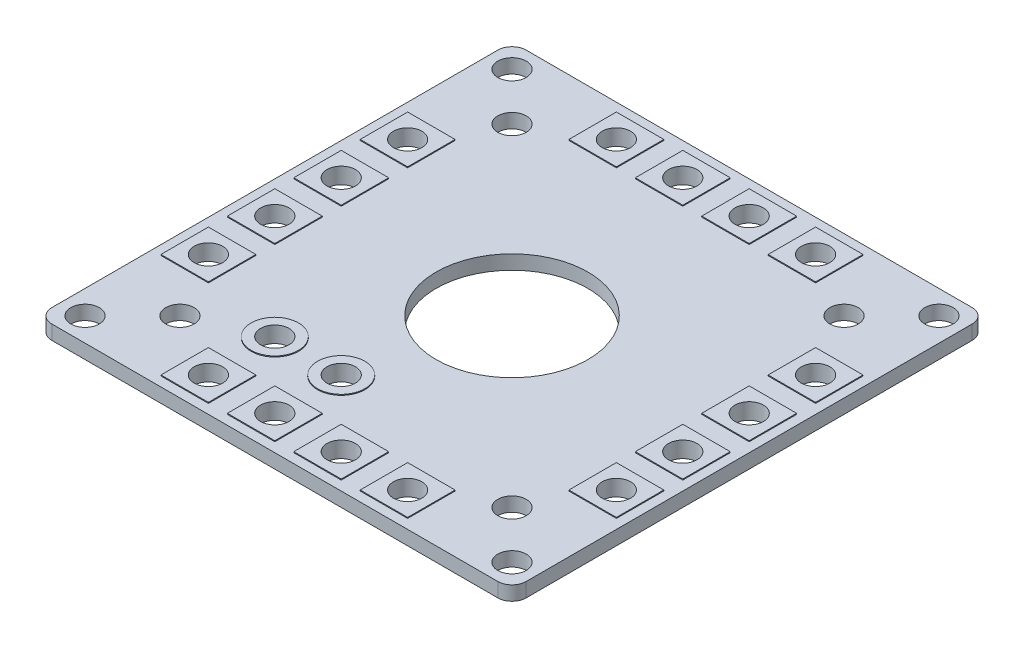
from build123d import *

# Parameters (mm, degrees)
SKETCH_1_R           = 1.5
EXTRUDE_1_DEPTH      = 1.5
SKETCH_2_R           = 8
SKETCH_2_W           = 5
SKETCH_2_H           = 5
SKETCH_2_R_2         = 2.5
CUT_EXTRUDE_1_DEPTH  = 36.387144558
EXTRUDE_2_DEPTH      = 1.6
EXTRUDE_2_DEPTH_BACK = 0.1
SKETCH_3_R           = 2.5
SKETCH_3_R_2         = 1.5
SKETCH_3_W           = 5
SKETCH_3_H           = 5


with BuildPart() as part:
    # Эскиз1 → Бобышка-Вытянуть1 (new body)
    with BuildSketch(Plane(origin=(0, 0, 0), x_dir=(1, 0, 0), z_dir=(0, 1, 0))):
        with BuildLine():
            Line((-23.5, 25), (23.5, 25))
            ThreePointArc((23.5, 25), (24.560660172, 24.560660172), (25, 23.5))
            Line((25, 23.5), (25, -23.5))
            ThreePointArc((25, -23.5), (24.560660172, -24.560660172), (23.5, -25))
            Line((23.5, -25), (-23.5, -25))
            ThreePointArc((-23.5, -25), (-24.560660172, -24.560660172), (-25, -23.5))
            Line((-25, -23.5), (-25, 23.5))
            ThreePointArc((-25, 23.5), (-24.560660172, 24.560660172), (-23.5, 25))
        make_face()
        with Locations(Location((-22.5, 22.5, 0), (0, 0, 270))):
            Circle(SKETCH_1_R, mode=Mode.SUBTRACT)
        with Locations(Location((22.5, 22.5, 0), (0, 0, 270))):
            Circle(SKETCH_1_R, mode=Mode.SUBTRACT)
        with Locations(Location((22.5, -22.5, 0), (0, 0, 270))):
            Circle(SKETCH_1_R, mode=Mode.SUBTRACT)
        with Locations(Location((-22.5, -22.5, 0), (0, 0, 270))):
            Circle(SKETCH_1_R, mode=Mode.SUBTRACT)
        with Locations(Location((-17.5, 17.5, 0), (0, 0, 270))):
            Circle(SKETCH_1_R, mode=Mode.SUBTRACT)
        with Locations(Location((17.5, 17.5, 0), (0, 0, 270))):
            Circle(SKETCH_1_R, mode=Mode.SUBTRACT)
        with Locations(Location((17.5, -17.5, 0), (0, 0, 270))):
            Circle(SKETCH_1_R, mode=Mode.SUBTRACT)
        with Locations(Location((-17.5, -17.5, 0), (0, 0, 270))):
            Circle(SKETCH_1_R, mode=Mode.SUBTRACT)
    extrude(amount=EXTRUDE_1_DEPTH)

    # Эскиз2 → Вырез-Вытянуть1 (cut, through all)
    with BuildSketch(Plane(origin=(0, 1.5, 0), x_dir=(1, 0, 0), z_dir=(0, 1, 0))):
        with Locations(Location((0, 0, 0), (0, 0, 270))):
            Circle(SKETCH_2_R)
        with Locations((-10.5, 21.5)):
            Rectangle(SKETCH_2_W, SKETCH_2_H)
        with Locations((-21.5, 10.5)):
            Rectangle(SKETCH_2_W, SKETCH_2_H)
        with Locations((-21.5, 3.5)):
            Rectangle(SKETCH_2_W, SKETCH_2_H)
        with Locations((-21.5, -3.5)):
            Rectangle(SKETCH_2_W, SKETCH_2_H)
        with Locations((-21.5, -10.5)):
            Rectangle(SKETCH_2_W, SKETCH_2_H)
        with Locations((-10.5, -21.5)):
            Rectangle(SKETCH_2_W, SKETCH_2_H)
        with Locations((-3.5, -21.5)):
            Rectangle(SKETCH_2_W, SKETCH_2_H)
        with Locations((3.5, -21.5)):
            Rectangle(SKETCH_2_W, SKETCH_2_H)
        with Locations((10.5, -21.5)):
            Rectangle(SKETCH_2_W, SKETCH_2_H)
        with Locations((21.5, -10.5)):
            Rectangle(SKETCH_2_W, SKETCH_2_H)
        with Locations((21.5, -3.5)):
            Rectangle(SKETCH_2_W, SKETCH_2_H)
        with Locations((21.5, 3.5)):
            Rectangle(SKETCH_2_W, SKETCH_2_H)
        with Locations((21.5, 10.5)):
            Rectangle(SKETCH_2_W, SKETCH_2_H)
        with Locations((-3.5, 21.5)):
            Rectangle(SKETCH_2_W, SKETCH_2_H)
        with Locations((10.5, 21.5)):
            Rectangle(SKETCH_2_W, SKETCH_2_H)
        with Locations((3.5, 21.5)):
            Rectangle(SKETCH_2_W, SKETCH_2_H)
        with Locations(Location((-10.5, -14.5, 0), (0, 0, 270))):
            Circle(SKETCH_2_R_2)
        with Locations(Location((-3.5, -14.5, 0), (0, 0, 270))):
            Circle(SKETCH_2_R_2)
    extrude(amount=-CUT_EXTRUDE_1_DEPTH, mode=Mode.SUBTRACT)

    # Эскиз3 → Бобышка-Вытянуть2 (add, two sides: drawn at the far end of the back side and taken through both)
    # profile 1 of 18: a face of its own
    with BuildSketch(Plane(origin=(0, 0, 0), x_dir=(1, 0, 0), z_dir=(0, 1, 0)).offset(-EXTRUDE_2_DEPTH_BACK)):
        with Locations(Location((-10.5, -14.5, 0), (0, 0, 270))):
            Circle(SKETCH_3_R)
        with Locations(Location((-10.5, -14.5, 0), (0, 0, 270))):
            Circle(SKETCH_3_R_2, mode=Mode.SUBTRACT)
    # profile 2 of 18: a face of its own
    with BuildSketch(Plane(origin=(0, 0, 0), x_dir=(1, 0, 0), z_dir=(0, 1, 0)).offset(-EXTRUDE_2_DEPTH_BACK)):
        with Locations(Location((-3.5, -14.5, 0), (0, 0, 270))):
            Circle(SKETCH_3_R)
        with Locations(Location((-3.5, -14.5, 0), (0, 0, 270))):
            Circle(SKETCH_3_R_2, mode=Mode.SUBTRACT)
    # profile 3 of 18: a face of its own
    with BuildSketch(Plane(origin=(0, 0, 0), x_dir=(1, 0, 0), z_dir=(0, 1, 0)).offset(-EXTRUDE_2_DEPTH_BACK)):
        with Locations((-10.5, 21.5)):
            Rectangle(SKETCH_3_W, SKETCH_3_H)
        with Locations(Location((-10.5, 21.5, 0), (0, 0, 270))):
            Circle(SKETCH_3_R_2, mode=Mode.SUBTRACT)
    # profile 4 of 18: a face of its own
    with BuildSketch(Plane(origin=(0, 0, 0), x_dir=(1, 0, 0), z_dir=(0, 1, 0)).offset(-EXTRUDE_2_DEPTH_BACK)):
        with Locations((-3.5, 21.5)):
            Rectangle(SKETCH_3_W, SKETCH_3_H)
        with Locations(Location((-3.5, 21.5, 0), (0, 0, 270))):
            Circle(SKETCH_3_R_2, mode=Mode.SUBTRACT)
    # profile 5 of 18: a face of its own
    with BuildSketch(Plane(origin=(0, 0, 0), x_dir=(1, 0, 0), z_dir=(0, 1, 0)).offset(-EXTRUDE_2_DEPTH_BACK)):
        with Locations((3.5, 21.5)):
            Rectangle(SKETCH_3_W, SKETCH_3_H)
        with Locations(Location((3.5, 21.5, 0), (0, 0, 270))):
            Circle(SKETCH_3_R_2, mode=Mode.SUBTRACT)
    # profile 6 of 18: a face of its own
    with BuildSketch(Plane(origin=(0, 0, 0), x_dir=(1, 0, 0), z_dir=(0, 1, 0)).offset(-EXTRUDE_2_DEPTH_BACK)):
        with Locations((10.5, 21.5)):
            Rectangle(SKETCH_3_W, SKETCH_3_H)
        with Locations(Location((10.5, 21.5, 0), (0, 0, 270))):
            Circle(SKETCH_3_R_2, mode=Mode.SUBTRACT)
    # profile 7 of 18: a face of its own
    with BuildSketch(Plane(origin=(0, 0, 0), x_dir=(1, 0, 0), z_dir=(0, 1, 0)).offset(-EXTRUDE_2_DEPTH_BACK)):
        with Locations((-21.5, 10.5)):
            Rectangle(SKETCH_3_W, SKETCH_3_H)
        with Locations(Location((-21.5, 10.5, 0), (0, 0, 270))):
            Circle(SKETCH_3_R_2, mode=Mode.SUBTRACT)
    # profile 8 of 18: a face of its own
    with BuildSketch(Plane(origin=(0, 0, 0), x_dir=(1, 0, 0), z_dir=(0, 1, 0)).offset(-EXTRUDE_2_DEPTH_BACK)):
        with Locations((-21.5, 3.5)):
            Rectangle(SKETCH_3_W, SKETCH_3_H)
        with Locations(Location((-21.5, 3.5, 0), (0, 0, 270))):
            Circle(SKETCH_3_R_2, mode=Mode.SUBTRACT)
    # profile 9 of 18: a face of its own
    with BuildSketch(Plane(origin=(0, 0, 0), x_dir=(1, 0, 0), z_dir=(0, 1, 0)).offset(-EXTRUDE_2_DEPTH_BACK)):
        with Locations((-21.5, -3.5)):
            Rectangle(SKETCH_3_W, SKETCH_3_H)
        with Locations(Location((-21.5, -3.5, 0), (0, 0, 270))):
            Circle(SKETCH_3_R_2, mode=Mode.SUBTRACT)
    # profile 10 of 18: a face of its own
    with BuildSketch(Plane(origin=(0, 0, 0), x_dir=(1, 0, 0), z_dir=(0, 1, 0)).offset(-EXTRUDE_2_DEPTH_BACK)):
        with Locations((-21.5, -10.5)):
            Rectangle(SKETCH_3_W, SKETCH_3_H)
        with Locations(Location((-21.5, -10.5, 0), (0, 0, 270))):
            Circle(SKETCH_3_R_2, mode=Mode.SUBTRACT)
    # profile 11 of 18: a face of its own
    with BuildSketch(Plane(origin=(0, 0, 0), x_dir=(1, 0, 0), z_dir=(0, 1, 0)).offset(-EXTRUDE_2_DEPTH_BACK)):
        with Locations((-10.5, -21.5)):
            Rectangle(SKETCH_3_W, SKETCH_3_H)
        with Locations(Location((-10.5, -21.5, 0), (0, 0, 270))):
            Circle(SKETCH_3_R_2, mode=Mode.SUBTRACT)
    # profile 12 of 18: a face of its own
    with BuildSketch(Plane(origin=(0, 0, 0), x_dir=(1, 0, 0), z_dir=(0, 1, 0)).offset(-EXTRUDE_2_DEPTH_BACK)):
        with Locations((-3.5, -21.5)):
            Rectangle(SKETCH_3_W, SKETCH_3_H)
        with Locations(Location((-3.5, -21.5, 0), (0, 0, 270))):
            Circle(SKETCH_3_R_2, mode=Mode.SUBTRACT)
    # profile 13 of 18: a face of its own
    with BuildSketch(Plane(origin=(0, 0, 0), x_dir=(1, 0, 0), z_dir=(0, 1, 0)).offset(-EXTRUDE_2_DEPTH_BACK)):
        with Locations((3.5, -21.5)):
            Rectangle(SKETCH_3_W, SKETCH_3_H)
        with Locations(Location((3.5, -21.5, 0), (0, 0, 270))):
            Circle(SKETCH_3_R_2, mode=Mode.SUBTRACT)
    # profile 14 of 18: a face of its own
    with BuildSketch(Plane(origin=(0, 0, 0), x_dir=(1, 0, 0), z_dir=(0, 1, 0)).offset(-EXTRUDE_2_DEPTH_BACK)):
        with Locations((10.5, -21.5)):
            Rectangle(SKETCH_3_W, SKETCH_3_H)
        with Locations(Location((10.5, -21.5, 0), (0, 0, 270))):
            Circle(SKETCH_3_R_2, mode=Mode.SUBTRACT)
    # profile 15 of 18: a face of its own
    with BuildSketch(Plane(origin=(0, 0, 0), x_dir=(1, 0, 0), z_dir=(0, 1, 0)).offset(-EXTRUDE_2_DEPTH_BACK)):
        with Locations((21.5, -10.5)):
            Rectangle(SKETCH_3_W, SKETCH_3_H)
        with Locations(Location((21.5, -10.5, 0), (0, 0, 270))):
            Circle(SKETCH_3_R_2, mode=Mode.SUBTRACT)
    # profile 16 of 18: a face of its own
    with BuildSketch(Plane(origin=(0, 0, 0), x_dir=(1, 0, 0), z_dir=(0, 1, 0)).offset(-EXTRUDE_2_DEPTH_BACK)):
        with Locations((21.5, -3.5)):
            Rectangle(SKETCH_3_W, SKETCH_3_H)
        with Locations(Location((21.5, -3.5, 0), (0, 0, 270))):
            Circle(SKETCH_3_R_2, mode=Mode.SUBTRACT)
    # profile 17 of 18: a face of its own
    with BuildSketch(Plane(origin=(0, 0, 0), x_dir=(1, 0, 0), z_dir=(0, 1, 0)).offset(-EXTRUDE_2_DEPTH_BACK)):
        with Locations((21.5, 3.5)):
            Rectangle(SKETCH_3_W, SKETCH_3_H)
        with Locations(Location((21.5, 3.5, 0), (0, 0, 270))):
            Circle(SKETCH_3_R_2, mode=Mode.SUBTRACT)
    # profile 18 of 18: a face of its own
    with BuildSketch(Plane(origin=(0, 0, 0), x_dir=(1, 0, 0), z_dir=(0, 1, 0)).offset(-EXTRUDE_2_DEPTH_BACK)):
        with Locations((21.5, 10.5)):
            Rectangle(SKETCH_3_W, SKETCH_3_H)
        with Locations(Location((21.5, 10.5, 0), (0, 0, 270))):
            Circle(SKETCH_3_R_2, mode=Mode.SUBTRACT)
    extrude(amount=EXTRUDE_2_DEPTH + EXTRUDE_2_DEPTH_BACK)


solid = part.part
